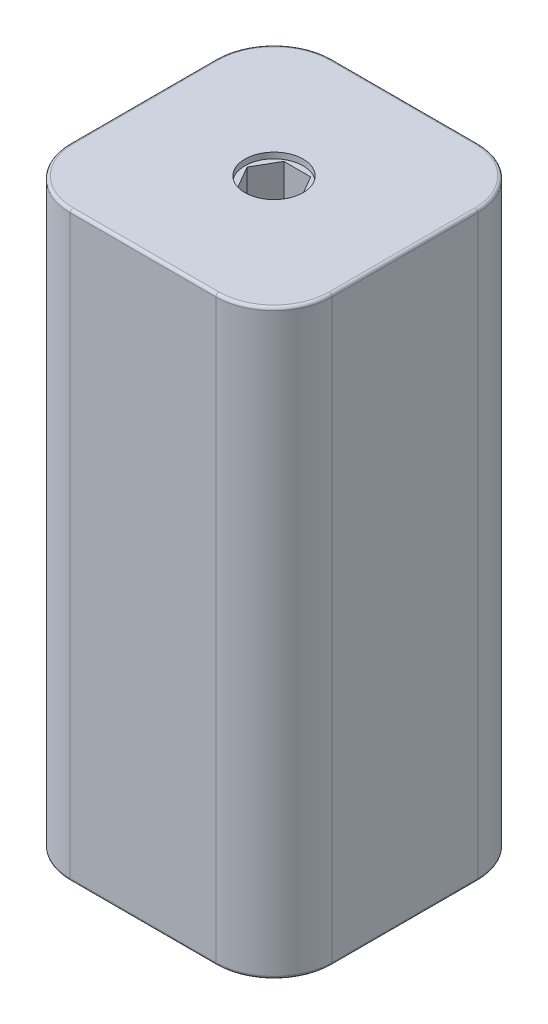
from build123d import *

# Parameters (mm, degrees)
SKETCH_1_W          = 45
SKETCH_1_H          = 45
EXTRUDE_1_DEPTH     = 100
FILLET_1_R          = 10
FILLET_2_R          = 0.5
SKETCH_2_R          = 5
CUT_EXTRUDE_1_DEPTH = 1
CUT_EXTRUDE_2_DEPTH = 12


with BuildPart() as part:
    # 草图1 → 凸台-拉伸1 (new body)
    with BuildSketch(Plane(origin=(0, 0, 0), x_dir=(1, 0, 0), z_dir=(0, 1, 0))):
        Rectangle(SKETCH_1_W, SKETCH_1_H)
    extrude(amount=-EXTRUDE_1_DEPTH)

    # 圆角1
    fillet_1_edges = [part.edges().sort_by_distance(p)[0] for p in [
        (22.5, -50, 22.5),
        (-22.5, -50, 22.5),
        (-22.5, -50, -22.5),
        (22.5, -50, -22.5),
    ]]
    fillet(fillet_1_edges, radius=FILLET_1_R)

    # 圆角2
    fillet_2_edges = [part.edges().sort_by_distance(p)[0] for p in [
        (0, 0, -22.5),
        (0, -100, -22.5),
        (22.5, 0, 0),
        (-22.5, 0, 0),
        (0, 0, 22.5),
        (-19.571067812, 0, 19.571067812),
        (19.571067812, 0, 19.571067812),
        (19.571067812, 0, -19.571067812),
        (-19.571067812, 0, -19.571067812),
        (-22.5, -100, 0),
        (22.5, -100, 0),
        (0, -100, 22.5),
        (-19.571067812, -100, 19.571067812),
        (19.571067812, -100, 19.571067812),
        (19.571067812, -100, -19.571067812),
        (-19.571067812, -100, -19.571067812),
    ]]
    fillet(fillet_2_edges, radius=FILLET_2_R)

    # 草图2 → 切除-拉伸1 (cut)
    with BuildSketch(Plane(origin=(0, 0, 0), x_dir=(1, 0, 0), z_dir=(0, 1, 0))):
        with Locations(Location((0, 0, 0), (0, 0, 270))):
            Circle(SKETCH_2_R)
    extrude(amount=-CUT_EXTRUDE_1_DEPTH, mode=Mode.SUBTRACT)

    # 草图3 → 切除-拉伸2 (cut)
    with BuildSketch(Plane(origin=(0, -1, 0), x_dir=(1, 0, 0), z_dir=(0, 1, 0))):
        Polygon((4.618802154, 0), (2.309401077, 4), (-2.309401077, 4), (-4.618802154, 0), (-2.309401077, -4), (2.309401077, -4), align=None)
    extrude(amount=-CUT_EXTRUDE_2_DEPTH, mode=Mode.SUBTRACT)


solid = part.part
